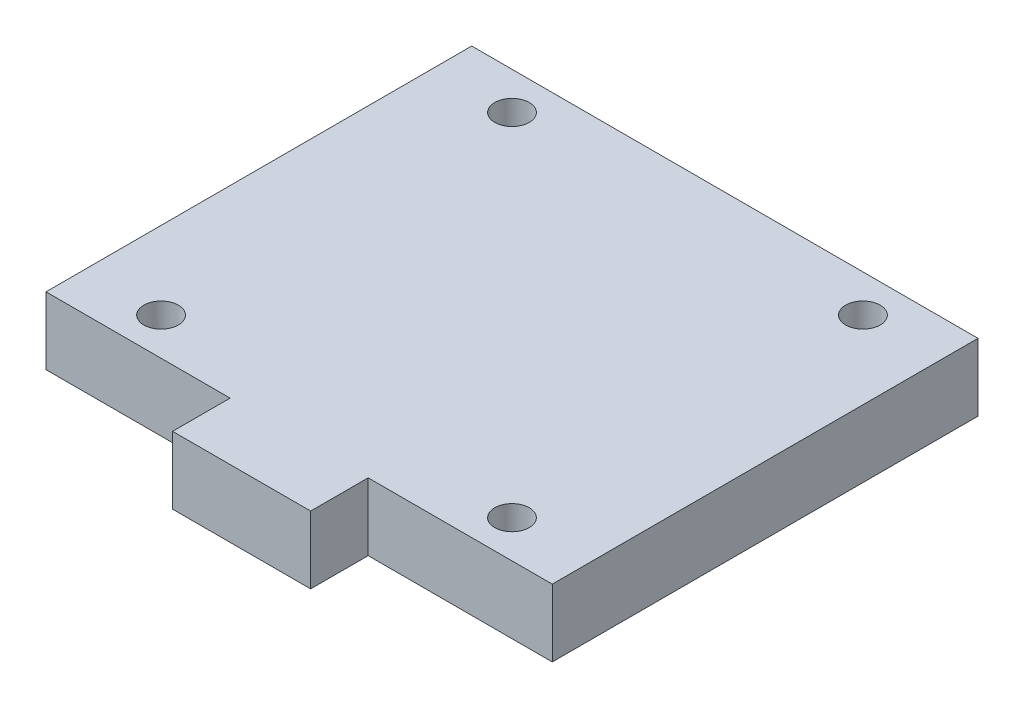
from build123d import *

# Parameters (mm, degrees)
SKETCH_1_W      = 44
SKETCH_1_H      = 37
SKETCH_1_R      = 1.5
SKETCH_1_W_2    = 12
SKETCH_1_H_2    = 5
EXTRUDE_1_DEPTH = 5.86


with BuildPart() as part:
    # 草图1 → 凸台-拉伸1 (new body)
    # profile 1 of 2: a face of its own
    with BuildSketch(Plane(origin=(0, 0, 0), x_dir=(1, 0, 0), z_dir=(0, 1, 0))):
        Rectangle(SKETCH_1_W, SKETCH_1_H)
        with Locations(Location((-15.25, -15.25, 0), (0, 0, 90))):
            Circle(SKETCH_1_R, mode=Mode.SUBTRACT)
        with Locations(Location((15.25, -15.25, 0), (0, 0, 90))):
            Circle(SKETCH_1_R, mode=Mode.SUBTRACT)
        with Locations(Location((15.25, 15.25, 0), (0, 0, 90))):
            Circle(SKETCH_1_R, mode=Mode.SUBTRACT)
        with Locations(Location((-15.25, 15.25, 0), (0, 0, 90))):
            Circle(SKETCH_1_R, mode=Mode.SUBTRACT)
    # profile 2 of 2: a face of its own
    with BuildSketch(Plane(origin=(0, 0, 0), x_dir=(1, 0, 0), z_dir=(0, 1, 0))):
        with Locations((0, -21)):
            Rectangle(SKETCH_1_W_2, SKETCH_1_H_2)
    extrude(amount=EXTRUDE_1_DEPTH)


solid = part.part
